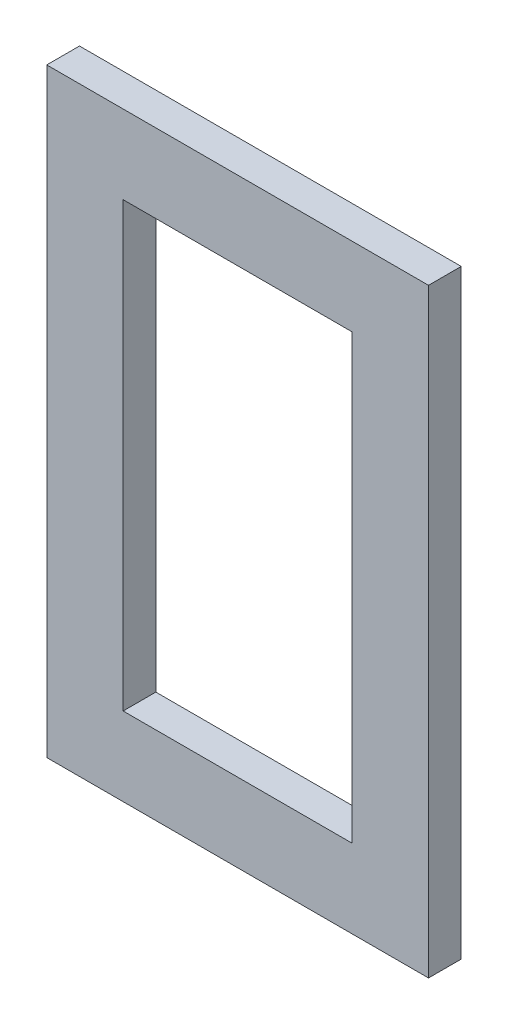
from build123d import *

# Parameters (mm, degrees)
SKETCH1_W           = 35
SKETCH1_H           = 55
BOSS_EXTRUDE1_DEPTH = 3
SKETCH2_W           = 21
SKETCH2_H           = 40.6
CUT_EXTRUDE1_DEPTH  = 3


with BuildPart() as part:
    # Sketch1 → Boss-Extrude1 (new body)
    with BuildSketch(Plane.XY):
        Rectangle(SKETCH1_W, SKETCH1_H)
    extrude(amount=BOSS_EXTRUDE1_DEPTH)

    # Sketch2 → Cut-Extrude1 (cut)
    with BuildSketch(Plane.XY.offset(3)):
        Rectangle(SKETCH2_W, SKETCH2_H)
    extrude(amount=-CUT_EXTRUDE1_DEPTH, mode=Mode.SUBTRACT)


solid = part.part
